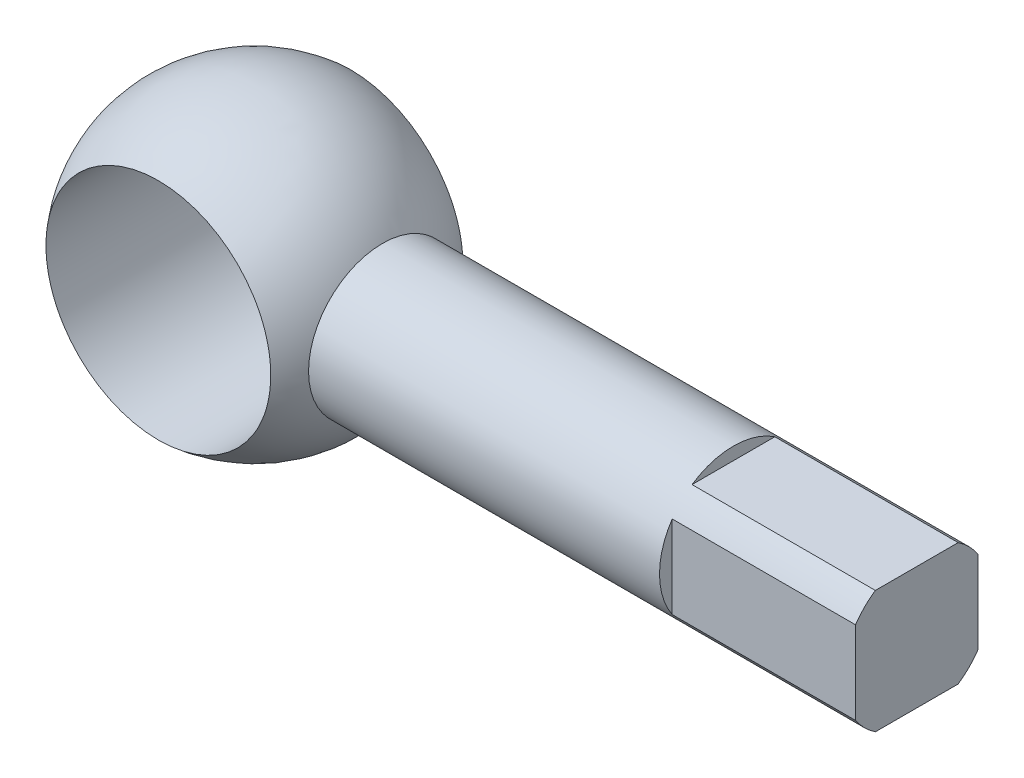
from build123d import *

# Parameters (mm, degrees)
CUT_EXTRUDE1_DEPTH      = 118.447860772
CUT_EXTRUDE1_DEPTH_BACK = 118.447860772
SKETCH3_R               = 19
CUT_EXTRUDE2_START      = -31
CUT_EXTRUDE2_DEPTH      = 172.206989852
CIRPATTERN1_COUNT       = 4


with BuildPart() as part:
    # Sketch2 → Revolve2 (revolve)
    with BuildSketch(Plane.XY):
        with BuildLine():
            Line((21.650635095, 12.5), (112, 12.5))
            Line((112, 12.5), (112, 0))
            Line((112, 0), (-25, 0))
            ThreePointArc((-25, 0), (-6.470476128, 24.148145657), (21.650635095, 12.5))
        make_face()
    revolve(axis=Axis((-25, 0, 0), (1, 0, 0)))

    # Sketch3 → Cut-Extrude1 (cut, two sides: drawn at the far end of the back side and taken through both)
    with BuildSketch(Plane.XY.offset(-CUT_EXTRUDE1_DEPTH_BACK)):
        Circle(SKETCH3_R)
    extrude(amount=CUT_EXTRUDE1_DEPTH + CUT_EXTRUDE1_DEPTH_BACK, mode=Mode.SUBTRACT)

    # Sketch4 → Cut-Extrude2 (cut)
    with BuildSketch(Plane(origin=(112, 0, 0), x_dir=(0, 0, -1), z_dir=(1, 0, 0)).offset(CUT_EXTRUDE2_START)):
        Polygon((-101.629332017, 10.356157589), (-7, 10.356157589), (7, 10.356157589), (101.629332017, 10.356157589), (101.629332017, 199.614821623), (-101.629332017, 199.614821623), align=None)
    cut_extrude2 = extrude(amount=CUT_EXTRUDE2_DEPTH, mode=Mode.SUBTRACT)

    # CirPattern1: Cut-Extrude2 ×4 about axis
    cirpattern1_axis = Axis((112, 0, 0), (-1, 0, 0))
    for i in range(1, CIRPATTERN1_COUNT):
        add(cut_extrude2.rotate(cirpattern1_axis, i * 360 / CIRPATTERN1_COUNT), mode=Mode.SUBTRACT)


solid = part.part
